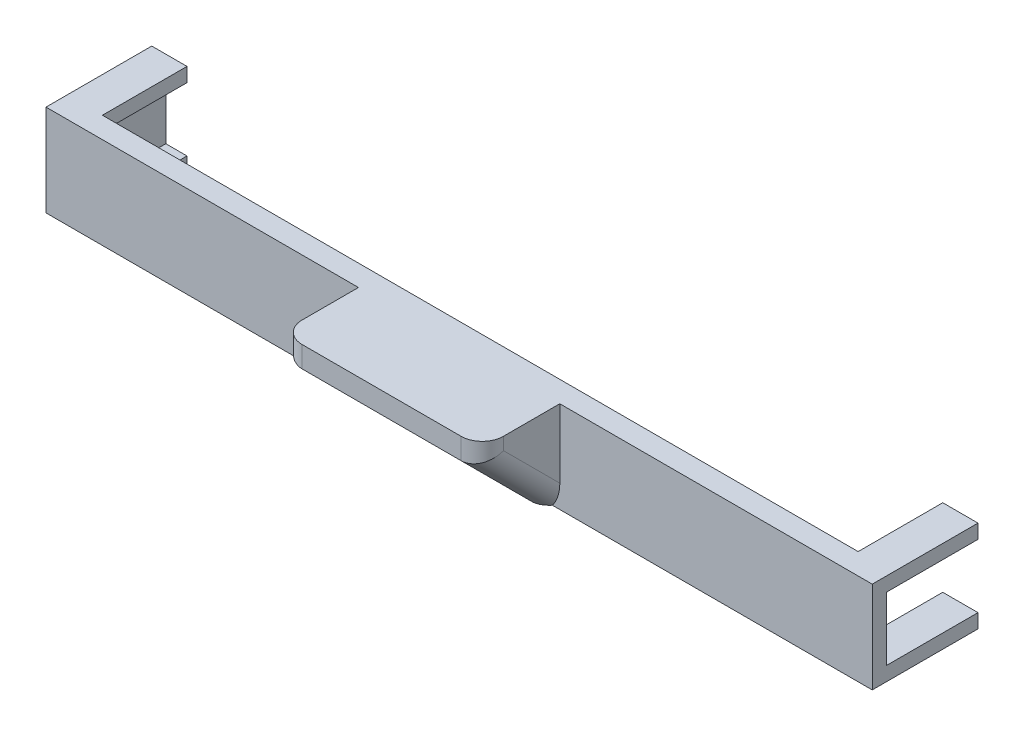
from build123d import *

# Parameters (mm, degrees)
SKETCH1_W           = 117.2
SKETCH1_H           = 13
SKETCH1_W_2         = 113.2
SKETCH1_H_2         = 9
BOSS_EXTRUDE1_DEPTH = 15
SKETCH2_W           = 117.2
SKETCH2_H           = 13
BOSS_EXTRUDE2_DEPTH = 2
SKETCH3_W           = 107.2
SKETCH3_H           = 12
CUT_EXTRUDE1_DEPTH  = 74.389715066
CUT_EXTRUDE2_REACH  = 125.963
SKETCH4_W           = 13
SKETCH4_H           = 9
SKETCH5_W           = 28.56
SKETCH5_H           = 13
BOSS_EXTRUDE3_DEPTH = 11
CHAMFER1_SIZE       = 10
FILLET1_R           = 3
FILLET2_R           = 3


with BuildPart() as part:
    # Sketch1 → Boss-Extrude1 (new body)
    with BuildSketch(Plane.XY):
        with Locations((-12.05444273, -30.99749435)):
            Rectangle(SKETCH1_W, SKETCH1_H)
        with Locations((-12.05444273, -30.99749435)):
            Rectangle(SKETCH1_W_2, SKETCH1_H_2, mode=Mode.SUBTRACT)
    extrude(amount=BOSS_EXTRUDE1_DEPTH)

    # Sketch2 → Boss-Extrude2 (add)
    with BuildSketch(Plane.XY.offset(15)):
        with Locations((-12.05444273, -30.99749435)):
            Rectangle(SKETCH2_W, SKETCH2_H)
    extrude(amount=-BOSS_EXTRUDE2_DEPTH)

    # Sketch3 → Cut-Extrude1 (cut, through all)
    with BuildSketch(Plane.XZ.offset(37.49749435)):
        with Locations((-12.05444273, 6)):
            Rectangle(SKETCH3_W, SKETCH3_H)
    extrude(amount=-CUT_EXTRUDE1_DEPTH, mode=Mode.SUBTRACT)

    # Sketch4 → Cut-Extrude2 (cut, up to next)
    with BuildSketch(Plane(origin=(46.54555727, 0, 0), x_dir=(0, 0, -1), z_dir=(1, 0, 0)), mode=Mode.PRIVATE) as cut_extrude2_sk1:
        with Locations((-6.5, -30.99749435)):
            Rectangle(SKETCH4_W, SKETCH4_H)
    cut_extrude2_tool1 = extrude(cut_extrude2_sk1.sketch, amount=-CUT_EXTRUDE2_REACH, mode=Mode.PRIVATE) & part.part
    add(cut_extrude2_tool1.solids().sort_by_distance((46.545557, -30.997494, 6.5))[0], mode=Mode.SUBTRACT)

    # Sketch5 → Boss-Extrude3 (add)
    with BuildSketch(Plane.XY.offset(15)):
        with Locations((-12.05444273, -30.99749435)):
            Rectangle(SKETCH5_W, SKETCH5_H)
    extrude(amount=BOSS_EXTRUDE3_DEPTH)

    # Chamfer1
    chamfer1_edges = [part.edges().sort_by_distance(p)[0] for p in [
        (-12.05444273, -37.49749435, 26),
    ]]
    chamfer(chamfer1_edges, length=CHAMFER1_SIZE)

    # Fillet1
    fillet1_edges = [part.edges().sort_by_distance(p)[0] for p in [
        (-26.33444273, -25.99749435, 26),
        (-26.33444273, -32.49749435, 21),
    ]]
    fillet(fillet1_edges, radius=FILLET1_R)

    # Fillet2
    fillet2_edges = [part.edges().sort_by_distance(p)[0] for p in [
        (2.22555727, -25.99749435, 26),
        (2.22555727, -32.49749435, 21),
    ]]
    fillet(fillet2_edges, radius=FILLET2_R)


solid = part.part
